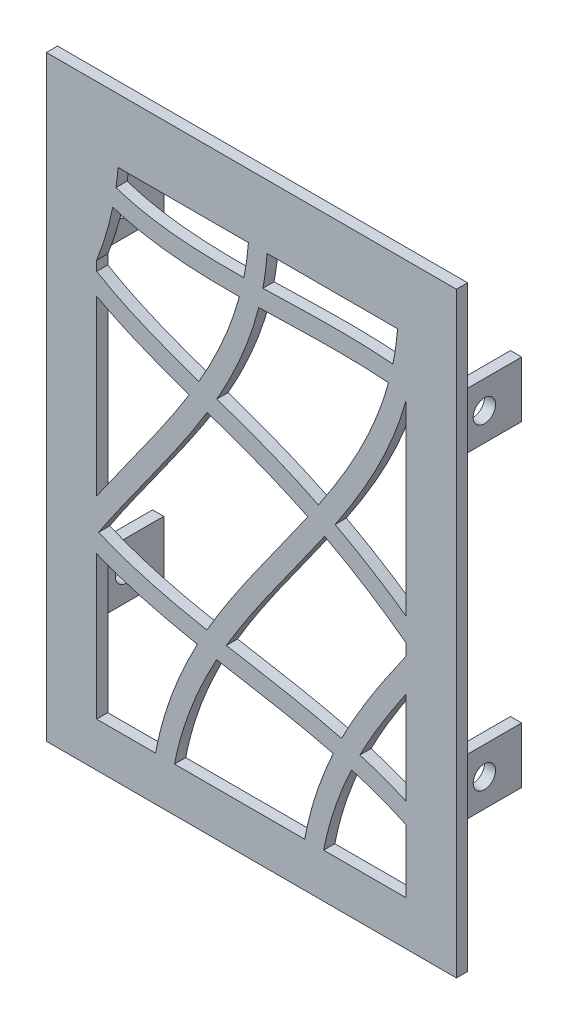
from build123d import *

# Parameters (mm, degrees)
SKETCH1_W           = 110
SKETCH1_H           = 160
BOSS_EXTRUDE1_DEPTH = 3
SKETCH2_W           = 3
SKETCH2_H           = 15
BOSS_EXTRUDE2_DEPTH = 20
FILLET1_R           = 5
SKETCH3_R           = 3
CUT_EXTRUDE1_DEPTH  = 120
CUT_EXTRUDE2_DEPTH  = 120


with BuildPart() as part:
    # Sketch1 → Boss-Extrude1 (new body)
    with BuildSketch(Plane.XY):
        with Locations((55, 80)):
            Rectangle(SKETCH1_W, SKETCH1_H)
    extrude(amount=BOSS_EXTRUDE1_DEPTH)

    # Sketch2 → Boss-Extrude2 (add)
    with BuildSketch(Plane(origin=(0, 0, 0), x_dir=(-1, 0, 0), z_dir=(0, 0, -1))):
        with Locations((-7, 122.5)):
            Rectangle(SKETCH2_W, SKETCH2_H)
        with Locations((-7, 37.5)):
            Rectangle(SKETCH2_W, SKETCH2_H)
        with Locations((-103, 37.5)):
            Rectangle(SKETCH2_W, SKETCH2_H)
        with Locations((-103, 122.5)):
            Rectangle(SKETCH2_W, SKETCH2_H)
    extrude(amount=BOSS_EXTRUDE2_DEPTH)

    # Fillet1
    fillet1_edges = [part.edges().sort_by_distance(p)[0] for p in [
        (8.5, 122.5, 0),
        (8.5, 37.5, 0),
        (101.5, 37.5, 0),
        (101.5, 122.5, 0),
    ]]
    fillet(fillet1_edges, radius=FILLET1_R)

    # Sketch3 → Cut-Extrude1 (cut)
    with BuildSketch(Plane(origin=(104.5, 0, 0), x_dir=(0, 0, -1), z_dir=(1, 0, 0))):
        with Locations((10, 122.5)):
            Circle(SKETCH3_R)
        with Locations((10, 37.5)):
            Circle(SKETCH3_R)
    extrude(amount=-CUT_EXTRUDE1_DEPTH, mode=Mode.SUBTRACT)

    # Sketch5 → Cut-Extrude2 (cut)
    with BuildSketch(Plane(origin=(0, 0, 0), x_dir=(-1, 0, 0), z_dir=(0, 0, -1))):
        with BuildLine():
            Line((-59.22368306, 142.920136265), (-94.208745648, 142.920136265))
            add(Edge.make_bspline(
                [(-94.208745648, 142.920136265), (-93.99944135, 140.316400211), (-93.599345271, 137.370584847), (-93.034477952, 134.480160039), (-92.956528352, 134.096903213)],
                knots=[0.146008746, 0.146008746, 0.146008746, 0.146008746, 0.1875, 0.193860762, 0.193860762, 0.193860762, 0.193860762], degree=3))
            add(Edge.make_bspline(
                [(-92.956528352, 134.096903203), (-89.401752044, 134.400648595), (-81.671392739, 134.738473009), (-69.966340656, 134.600211357), (-61.939676782, 134.350843055), (-58.083722594, 134.262215687)],
                knots=[0.321057764, 0.321057764, 0.321057764, 0.321057764, 0.375, 0.4375, 0.496655107, 0.496655107, 0.496655107, 0.496655107], degree=3))
            add(Edge.make_bspline(
                [(-59.22368306, 142.920136265), (-59.003941592, 139.998174784), (-58.619091031, 137.113202543), (-58.08790054, 134.284413408), (-58.083722594, 134.262215685)],
                knots=[0.144019694, 0.144019694, 0.144019694, 0.144019694, 0.1875, 0.187843946, 0.187843946, 0.187843946, 0.187843946], degree=3))
        make_face()
        with BuildLine():
            Line((-19.22368306, 142.920136265), (-54.208745648, 142.920136265))
            add(Edge.make_bspline(
                [(-54.208745648, 142.920136265), (-53.99944135, 140.316400211), (-53.602694013, 137.395240867), (-53.043922114, 134.528548739), (-52.971218879, 134.169311433)],
                knots=[0.146008746, 0.146008746, 0.146008746, 0.146008746, 0.1875, 0.193460248, 0.193460248, 0.193460248, 0.193460248], degree=3))
            add(Edge.make_bspline(
                [(-52.971218879, 134.169311432), (-50.425228683, 134.138390436), (-43.92437552, 134.130784179), (-33.821695723, 134.63436025), (-25.034223117, 136.061405588), (-20.162596733, 137.464864438), (-18.690107675, 137.958223257)],
                knots=[0.522954544, 0.522954544, 0.522954544, 0.522954544, 0.5625, 0.625, 0.6875, 0.71544802, 0.71544802, 0.71544802, 0.71544802], degree=3))
            add(Edge.make_bspline(
                [(-19.22368306, 142.920136265), (-19.097848591, 141.246881447), (-18.918861113, 139.593181275), (-18.690107675, 137.958223257)],
                knots=[0.144019694, 0.144019694, 0.144019694, 0.144019694, 0.168918596, 0.168918596, 0.168918596, 0.168918596], degree=3))
        make_face()
        with BuildLine():
            add(Edge.make_bspline(
                [(-91.788334917, 129.17623964), (-88.612438501, 129.428494658), (-81.368746091, 129.733302938), (-69.883805447, 129.599436315), (-61.450655613, 129.332947205), (-57.162146375, 129.240484623), (-56.973254726, 129.23650413)],
                knots=[0.324961962, 0.324961962, 0.324961962, 0.324961962, 0.375, 0.4375, 0.5, 0.502880474, 0.502880474, 0.502880474, 0.502880474], degree=3))
            add(Edge.make_bspline(
                [(-91.788334917, 129.17623964), (-91.329922486, 127.486270288), (-89.69927154, 122.162168456), (-86.103159534, 113.444279587), (-80.269784459, 102.558078466), (-75.609557756, 95.275825611), (-72.987202542, 91.378661266)],
                knots=[0.221368579, 0.221368579, 0.221368579, 0.221368579, 0.25, 0.3125, 0.375, 0.447691491, 0.447691491, 0.447691491, 0.447691491], degree=3))
            add(Edge.make_bspline(
                [(-45.742261826, 102.366254933), (-45.897287181, 102.312343939), (-50.049303772, 100.867995721), (-58.252958248, 97.981143321), (-67.144625347, 94.206681306), (-71.972028616, 91.880496711), (-72.987202542, 91.378661266)],
                knots=[0.435075211, 0.435075211, 0.435075211, 0.435075211, 0.4375, 0.5, 0.5625, 0.579276555, 0.579276555, 0.579276555, 0.579276555], degree=3))
            add(Edge.make_bspline(
                [(-56.973254727, 129.236504129), (-56.399382119, 126.973520555), (-54.578485345, 120.867085795), (-50.871782625, 111.890230892), (-47.415927143, 105.31685639), (-45.742261826, 102.366254933)],
                knots=[0.214107365, 0.214107365, 0.214107365, 0.214107365, 0.25, 0.3125, 0.364749575, 0.364749575, 0.364749575, 0.364749575], degree=3))
        make_face()
        with BuildLine():
            add(Edge.make_bspline(
                [(-96.5, 127.451406693), (-96.043061468, 125.799513354), (-94.345305866, 120.302374105), (-90.61956063, 111.279402233), (-84.660802212, 100.167638212), (-80.013506949, 92.87965835), (-77.467302505, 89.080176162)],
                knots=[0.223583893, 0.223583893, 0.223583893, 0.223583893, 0.25, 0.3125, 0.375, 0.444675036, 0.444675036, 0.444675036, 0.444675036], degree=3))
            Line((-96.5, 127.451406693), (-96.5, 77.272890815))
            add(Edge.make_bspline(
                [(-77.467302505, 89.080176162), (-78.703272058, 88.4226225), (-85.275805604, 84.820465941), (-91.573329563, 80.806210146), (-96.5, 77.272890815)],
                knots=[0.604187759, 0.604187759, 0.604187759, 0.604187759, 0.625, 0.715736933, 0.715736933, 0.715736933, 0.715736933], degree=3))
        make_face()
        with BuildLine():
            add(Edge.make_bspline(
                [(-51.783036891, 129.156717703), (-49.621134395, 129.138506996), (-43.41343904, 129.150233882), (-33.346778368, 129.647307037), (-24.25996612, 131.113897661), (-19.204110631, 132.537601764), (-17.831224819, 132.977891168)],
                knots=[0.529335683, 0.529335683, 0.529335683, 0.529335683, 0.5625, 0.625, 0.6875, 0.711230744, 0.711230744, 0.711230744, 0.711230744], degree=3))
            add(Edge.make_bspline(
                [(-51.783036891, 129.156717704), (-51.325976218, 127.473388285), (-49.696690849, 122.155912207), (-46.229593663, 113.750788028), (-42.732069216, 107.156224872), (-40.939175567, 104.038090465)],
                knots=[0.221478831, 0.221478831, 0.221478831, 0.221478831, 0.25, 0.3125, 0.36959854, 0.36959854, 0.36959854, 0.36959854], degree=3))
            add(Edge.make_bspline(
                [(-13.5, 115.889602641), (-16.516619589, 114.075652945), (-23.198482253, 110.67879653), (-32.594769868, 106.985840187), (-38.724158539, 104.813071543), (-40.939175567, 104.038090465)],
                knots=[0.25491078, 0.25491078, 0.25491078, 0.25491078, 0.3125, 0.375, 0.409938869, 0.409938869, 0.409938869, 0.409938869], degree=3))
            Line((-13.5, 115.889602641), (-13.5, 118.459526964))
            add(Edge.make_bspline(
                [(-17.831224816, 132.977891162), (-17.101368241, 129.417258322), (-15.752629618, 124.537796604), (-14.026697752, 119.811160908), (-13.5, 118.459526964)],
                knots=[0.194497278, 0.194497278, 0.194497278, 0.194497278, 0.25, 0.272500699, 0.272500699, 0.272500699, 0.272500699], degree=3))
        make_face()
        with BuildLine():
            add(Edge.make_bspline(
                [(-43.162318865, 97.973613063), (-47.616916181, 96.426495189), (-56.03873012, 93.488060349), (-64.880664831, 89.734833949), (-69.35935627, 87.588489846), (-70.136241151, 87.208587403)],
                knots=[0.430171951, 0.430171951, 0.430171951, 0.430171951, 0.5, 0.5625, 0.575692221, 0.575692221, 0.575692221, 0.575692221], degree=3))
            add(Edge.make_bspline(
                [(-70.136241151, 87.208587403), (-69.159225204, 85.799609952), (-63.479489305, 77.711753256), (-55.081430319, 66.271448639), (-47.153336235, 54.255511295), (-44.029489963, 49.039237467), (-43.064197042, 47.364034792)],
                knots=[0.473654633, 0.473654633, 0.473654633, 0.473654633, 0.5, 0.625, 0.6875, 0.716664954, 0.716664954, 0.716664954, 0.716664954], degree=3))
            add(Edge.make_bspline(
                [(-43.064197041, 47.364034807), (-41.225792491, 47.716389397), (-35.949486564, 48.770282181), (-27.413187954, 50.783159542), (-19.632176846, 53.249648198), (-15.260326631, 55.004453397), (-14.017205713, 55.53856169)],
                knots=[0.529374331, 0.529374331, 0.529374331, 0.529374331, 0.5625, 0.625, 0.6875, 0.71276409, 0.71276409, 0.71276409, 0.71276409], degree=3))
            add(Edge.make_bspline(
                [(-43.162318865, 97.973613063), (-39.473238018, 91.892434104), (-30.763882948, 79.186948618), (-20.541132703, 65.257074219), (-14.988616054, 57.011550923), (-14.017205713, 55.53856169)],
                knots=[0.390856808, 0.390856808, 0.390856808, 0.390856808, 0.5, 0.625, 0.652056904, 0.652056904, 0.652056904, 0.652056904], degree=3))
        make_face()
        with BuildLine():
            add(Edge.make_bspline(
                [(-74.635067654, 84.922163676), (-75.999027868, 84.202375001), (-83.613199523, 80.046052336), (-90.837817891, 75.327122016), (-96.5, 71.070077492)],
                knots=[0.601396797, 0.601396797, 0.601396797, 0.601396797, 0.625, 0.734335253, 0.734335253, 0.734335253, 0.734335253], degree=3))
            Line((-96.5, 71.070077492), (-96.5, 68.016133661))
            add(Edge.make_bspline(
                [(-96.5, 68.016133661), (-95.273246632, 66.274578134), (-91.682895659, 61.120578947), (-85.933557161, 52.406795984), (-81.538936437, 44.796641574), (-79.416964585, 40.672492898), (-79.191816983, 40.229037312)],
                knots=[0.592877727, 0.592877727, 0.592877727, 0.592877727, 0.625, 0.6875, 0.75, 0.757506799, 0.757506799, 0.757506799, 0.757506799], degree=3))
            add(Edge.make_bspline(
                [(-79.191816977, 40.229037317), (-75.868436603, 41.098971588), (-65.578240854, 43.435790821), (-55.187106172, 45.152412187), (-48.287707818, 46.395969151)],
                knots=[0.315517153, 0.315517153, 0.315517153, 0.315517153, 0.375, 0.498155689, 0.498155689, 0.498155689, 0.498155689], degree=3))
            add(Edge.make_bspline(
                [(-74.635067654, 84.922163676), (-73.519427236, 83.308018138), (-67.659088184, 74.956247479), (-59.153974238, 63.366883936), (-51.703258788, 52.070866578), (-48.943527277, 47.507548883), (-48.287707819, 46.395969136)],
                knots=[0.470186995, 0.470186995, 0.470186995, 0.470186995, 0.5, 0.625, 0.6875, 0.707512043, 0.707512043, 0.707512043, 0.707512043], degree=3))
        make_face()
        with BuildLine():
            add(Edge.make_bspline(
                [(-13.5, 110.119044841), (-15.9332349, 108.773406836), (-22.14087656, 105.719044737), (-30.548116461, 102.416748615), (-36.424138816, 100.325570538), (-38.33112646, 99.656390238)],
                knots=[0.270066815, 0.270066815, 0.270066815, 0.270066815, 0.3125, 0.375, 0.40492604, 0.40492604, 0.40492604, 0.40492604], degree=3))
            add(Edge.make_bspline(
                [(-38.33112646, 99.656390238), (-34.884706153, 94.048061283), (-26.722361097, 82.149541749), (-17.988337604, 70.231908709), (-13.5, 63.711288364)],
                knots=[0.396457899, 0.396457899, 0.396457899, 0.396457899, 0.5, 0.619234868, 0.619234868, 0.619234868, 0.619234868], degree=3))
            Line((-13.5, 63.711288364), (-13.5, 110.119044841))
        make_face()
        with BuildLine():
            add(Edge.make_bspline(
                [(-40.512345057, 42.766096644), (-39.1876748, 43.026572868), (-34.360412381, 44.007666374), (-26.109048827, 45.951530149), (-18.481114267, 48.366417371), (-14.338816218, 49.990650031), (-13.5, 50.333867525)],
                knots=[0.53892324, 0.53892324, 0.53892324, 0.53892324, 0.5625, 0.625, 0.6875, 0.703481953, 0.703481953, 0.703481953, 0.703481953], degree=3))
            add(Edge.make_bspline(
                [(-40.512345058, 42.766096632), (-40.297790644, 42.363634684), (-38.153994169, 38.297276859), (-34.452179975, 30.374740365), (-31.130962854, 20.475603596), (-29.719943673, 14.173948207), (-29.316337344, 11.978167291), (-29.299496155, 11.885706144)],
                knots=[0.74311624, 0.74311624, 0.74311624, 0.74311624, 0.75, 0.8125, 0.875, 0.90625, 0.907622784, 0.907622784, 0.907622784, 0.907622784], degree=3))
            Line((-29.299496155, 11.885706144), (-13.5, 11.885706144))
            Line((-13.5, 11.885706144), (-13.5, 50.333867525))
        make_face()
        with BuildLine():
            add(Edge.make_bspline(
                [(-96.5, 59.242142498), (-94.356870431, 56.092967675), (-90.039016666, 49.517694266), (-86.080840367, 42.660157199), (-84.172089194, 38.98303267), (-84.104282957, 38.85188757)],
                knots=[0.629310476, 0.629310476, 0.629310476, 0.629310476, 0.6875, 0.75, 0.752310012, 0.752310012, 0.752310012, 0.752310012], degree=3))
            Line((-96.5, 59.242142498), (-96.5, 34.333631829))
            add(Edge.make_bspline(
                [(-96.5, 34.333631829), (-94.374826459, 35.268613744), (-90.276753944, 36.888604487), (-86.100240739, 38.252493804), (-84.10428296, 38.851887596)],
                knots=[0.21007277, 0.21007277, 0.21007277, 0.21007277, 0.25, 0.286073111, 0.286073111, 0.286073111, 0.286073111], degree=3))
        make_face()
        with BuildLine():
            add(Edge.make_bspline(
                [(-45.667724917, 41.790123539), (-45.205555159, 40.945033779), (-42.865891841, 36.567160611), (-39.096947186, 28.494803751), (-36.014053823, 19.297135547), (-34.728471404, 13.650600747), (-34.386871701, 11.885706144)],
                knots=[0.734979488, 0.734979488, 0.734979488, 0.734979488, 0.75, 0.8125, 0.875, 0.902910081, 0.902910081, 0.902910081, 0.902910081], degree=3))
            add(Edge.make_bspline(
                [(-76.971157519, 35.638632709), (-74.062442979, 36.380415935), (-64.243814875, 38.592255688), (-53.664519271, 40.335226277), (-46.141195151, 41.703381382), (-45.667724916, 41.79012355)],
                knots=[0.321389701, 0.321389701, 0.321389701, 0.321389701, 0.375, 0.5, 0.508397675, 0.508397675, 0.508397675, 0.508397675], degree=3))
            add(Edge.make_bspline(
                [(-76.971157519, 35.638632709), (-76.159244398, 33.871032207), (-73.747361355, 28.273975595), (-71.130962854, 20.475603596), (-69.719943673, 14.173948207), (-69.316337344, 11.978167291), (-69.299496155, 11.885706144)],
                knots=[0.783158901, 0.783158901, 0.783158901, 0.783158901, 0.8125, 0.875, 0.90625, 0.907622784, 0.907622784, 0.907622784, 0.907622784], degree=3))
            Line((-69.299496155, 11.885706144), (-34.386871701, 11.885706144))
        make_face()
        with BuildLine():
            add(Edge.make_bspline(
                [(-96.5, 28.839797408), (-93.846866588, 30.090660186), (-89.035849157, 32.053854367), (-84.056146482, 33.65846085), (-81.862449765, 34.301577434)],
                knots=[0.196658703, 0.196658703, 0.196658703, 0.196658703, 0.25, 0.29109988, 0.29109988, 0.29109988, 0.29109988], degree=3))
            Line((-96.5, 28.839797408), (-96.5, 11.885706144))
            Line((-96.5, 11.885706144), (-74.386871701, 11.885706144))
            add(Edge.make_bspline(
                [(-81.862449765, 34.301577434), (-80.954571451, 32.360663737), (-78.515734297, 26.760782272), (-76.014053823, 19.297135547), (-74.728471404, 13.650600747), (-74.386871701, 11.885706144)],
                knots=[0.77882789, 0.77882789, 0.77882789, 0.77882789, 0.8125, 0.875, 0.902910081, 0.902910081, 0.902910081, 0.902910081], degree=3))
        make_face()
    extrude(amount=-CUT_EXTRUDE2_DEPTH, mode=Mode.SUBTRACT)


solid = part.part
